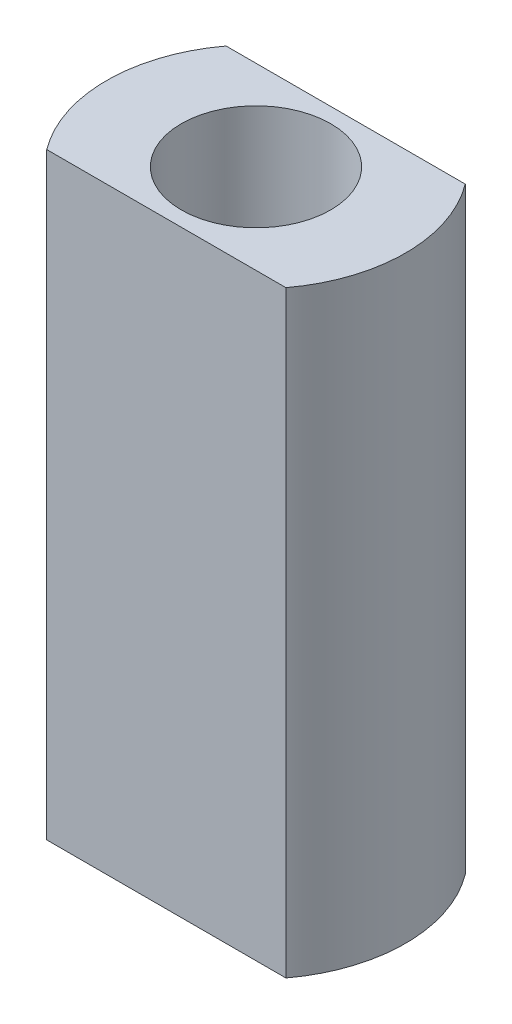
from build123d import *

# Parameters (mm, degrees)
SCHIZZO1_W                   = 8
SCHIZZO1_H                   = 6
ESTRUSIONE_ESTRUSIONE1_DEPTH = 20
SCHIZZO2_R                   = 2.5
TAGLIO_ESTRUSIONE1_DEPTH     = 20


with BuildPart() as part:
    # Schizzo1 → Estrusione-Estrusione1 (new body)
    with BuildSketch(Plane(origin=(0, 0, 0), x_dir=(1, 0, 0), z_dir=(0, 1, 0))):
        with BuildLine():
            Line((-4, -3), (-4, 3))
            ThreePointArc((-4, 3), (-5, 0), (-4, -3))
        make_face()
        Rectangle(SCHIZZO1_W, SCHIZZO1_H)
        with BuildLine():
            ThreePointArc((5, 0), (4.74341649, 1.58113883), (4, 3))
            Line((4, 3), (4, -3))
            ThreePointArc((4, -3), (4.74341649, -1.58113883), (5, 0))
        make_face()
    extrude(amount=ESTRUSIONE_ESTRUSIONE1_DEPTH)

    # Schizzo2 → Taglio-Estrusione1 (cut)
    with BuildSketch(Plane(origin=(0, 20, 0), x_dir=(1, 0, 0), z_dir=(0, 1, 0))):
        with Locations(Location((0, 0, 0), (0, 0, 270))):
            Circle(SCHIZZO2_R)
    extrude(amount=-TAGLIO_ESTRUSIONE1_DEPTH, mode=Mode.SUBTRACT)


solid = part.part
